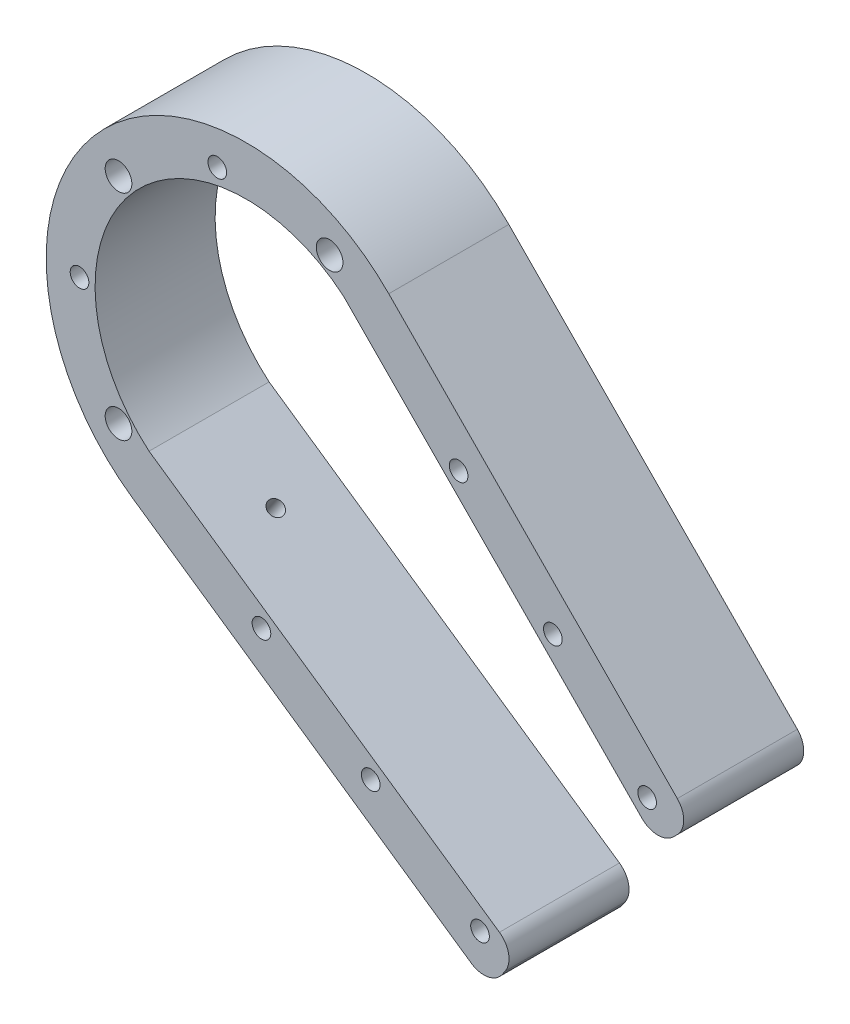
from build123d import *

# Parameters (mm, degrees)
SKETCH1_R           = 1.6
BOSS_EXTRUDE1_DEPTH = 27
CUT_EXTRUDE1_REACH  = 138.335
SKETCH2_R           = 2.1
CUT_EXTRUDE2_REACH  = 155.174
SKETCH3_R           = 1.7
SKETCH3_3_R         = 3
SKETCH3_3_R_2       = 1.7
CUT_EXTRUDE3_DEPTH  = 3
SKETCH4_R           = 3
CUT_EXTRUDE4_DEPTH  = 15


with BuildPart() as part:
    # Sketch1 → Boss-Extrude1 (new body)
    with BuildSketch(Plane.XY.offset(10)):
        with BuildLine():
            Line((-25.534872354, -37.053613776), (50.619597549, -89.534180987))
            ThreePointArc((50.619597549, -89.534180987), (54.361803385, -90.334528675), (57.573873786, -88.254320829))
            Line((57.573873786, -88.254320829), (58.227827632, -87.305369414))
            ThreePointArc((58.227827632, -87.305369414), (59.02817532, -83.563163578), (56.947967474, -80.351093178))
            Line((56.947967474, -80.351093178), (-21.854778729, -26.045511066))
            ThreePointArc((-21.854778729, -26.045511066), (-26.045511066, 21.854778729), (21.854778729, 26.045511066))
            Line((21.854778729, 26.045511066), (89.019290298, -42.129978983))
            ThreePointArc((89.019290298, -42.129978983), (92.543786433, -43.620813626), (96.090160837, -42.182797794))
            Line((96.090160837, -42.182797794), (96.911137653, -41.373995292))
            ThreePointArc((96.911137653, -41.373995292), (98.401972296, -37.849499157), (96.963956464, -34.303124754))
            Line((96.963956464, -34.303124754), (32.056602073, 31.581232775))
            ThreePointArc((32.056602073, 31.581232775), (-34.47199994, 28.925442436), (-25.534872354, -37.053613776))
        make_face()
        with Locations((90.17973297, -37.494440018)):
            Circle(SKETCH1_R, mode=Mode.SUBTRACT)
        with Locations((68.973861607, -16.273907044)):
            Circle(SKETCH1_R, mode=Mode.SUBTRACT)
        with Locations((47.767990244, 4.946625931)):
            Circle(SKETCH1_R, mode=Mode.SUBTRACT)
        with Locations((18.75, 32.475952642)):
            Circle(SKETCH1_R, mode=Mode.SUBTRACT)
        with Locations((-6.511806663, 36.930290738)):
            Circle(SKETCH1_R, mode=Mode.SUBTRACT)
        with Locations((-28.726666617, 24.104535363)):
            Circle(SKETCH1_R, mode=Mode.SUBTRACT)
        with Locations((-37.5, 0)):
            Circle(SKETCH1_R, mode=Mode.SUBTRACT)
        with Locations((-28.726666617, -24.104535363)):
            Circle(SKETCH1_R, mode=Mode.SUBTRACT)
        with Locations((3.423348889, -47.901259716)):
            Circle(SKETCH1_R, mode=Mode.SUBTRACT)
        with Locations((28.003855203, -65.100059364)):
            Circle(SKETCH1_R, mode=Mode.SUBTRACT)
        with Locations((52.584361518, -82.298859012)):
            Circle(SKETCH1_R, mode=Mode.SUBTRACT)
    extrude(amount=BOSS_EXTRUDE1_DEPTH)

    # Sketch2 → Cut-Extrude1 (cut, up to next)
    with BuildSketch(Plane.XY.offset(37), mode=Mode.PRIVATE) as cut_extrude1_sk1:
        with Locations((52.584361518, -82.298859012)):
            Circle(SKETCH2_R)
    cut_extrude1_tool1 = extrude(cut_extrude1_sk1.sketch, amount=-CUT_EXTRUDE1_REACH, mode=Mode.PRIVATE) & part.part
    # Sketch2 → Cut-Extrude1 (cut, up to next)
    with BuildSketch(Plane.XY.offset(37), mode=Mode.PRIVATE) as cut_extrude1_sk2:
        with Locations((28.003855203, -65.100059364)):
            Circle(SKETCH2_R)
    cut_extrude1_tool2 = extrude(cut_extrude1_sk2.sketch, amount=-CUT_EXTRUDE1_REACH, mode=Mode.PRIVATE) & part.part
    # Sketch2 → Cut-Extrude1 (cut, up to next)
    with BuildSketch(Plane.XY.offset(37), mode=Mode.PRIVATE) as cut_extrude1_sk3:
        with Locations((3.423348889, -47.901259716)):
            Circle(SKETCH2_R)
    cut_extrude1_tool3 = extrude(cut_extrude1_sk3.sketch, amount=-CUT_EXTRUDE1_REACH, mode=Mode.PRIVATE) & part.part
    # Sketch2 → Cut-Extrude1 (cut, up to next)
    with BuildSketch(Plane.XY.offset(37), mode=Mode.PRIVATE) as cut_extrude1_sk4:
        with Locations((-28.726666617, -24.104535363)):
            Circle(SKETCH2_R)
    cut_extrude1_tool4 = extrude(cut_extrude1_sk4.sketch, amount=-CUT_EXTRUDE1_REACH, mode=Mode.PRIVATE) & part.part
    # Sketch2 → Cut-Extrude1 (cut, up to next)
    with BuildSketch(Plane.XY.offset(37), mode=Mode.PRIVATE) as cut_extrude1_sk5:
        with Locations((-37.5, 0)):
            Circle(SKETCH2_R)
    cut_extrude1_tool5 = extrude(cut_extrude1_sk5.sketch, amount=-CUT_EXTRUDE1_REACH, mode=Mode.PRIVATE) & part.part
    # Sketch2 → Cut-Extrude1 (cut, up to next)
    with BuildSketch(Plane.XY.offset(37), mode=Mode.PRIVATE) as cut_extrude1_sk6:
        with Locations((-28.726666617, 24.104535363)):
            Circle(SKETCH2_R)
    cut_extrude1_tool6 = extrude(cut_extrude1_sk6.sketch, amount=-CUT_EXTRUDE1_REACH, mode=Mode.PRIVATE) & part.part
    # Sketch2 → Cut-Extrude1 (cut, up to next)
    with BuildSketch(Plane.XY.offset(37), mode=Mode.PRIVATE) as cut_extrude1_sk7:
        with Locations((-6.511806663, 36.930290738)):
            Circle(SKETCH2_R)
    cut_extrude1_tool7 = extrude(cut_extrude1_sk7.sketch, amount=-CUT_EXTRUDE1_REACH, mode=Mode.PRIVATE) & part.part
    # Sketch2 → Cut-Extrude1 (cut, up to next)
    with BuildSketch(Plane.XY.offset(37), mode=Mode.PRIVATE) as cut_extrude1_sk8:
        with Locations((18.75, 32.475952642)):
            Circle(SKETCH2_R)
    cut_extrude1_tool8 = extrude(cut_extrude1_sk8.sketch, amount=-CUT_EXTRUDE1_REACH, mode=Mode.PRIVATE) & part.part
    # Sketch2 → Cut-Extrude1 (cut, up to next)
    with BuildSketch(Plane.XY.offset(37), mode=Mode.PRIVATE) as cut_extrude1_sk9:
        with Locations((47.767990244, 4.946625931)):
            Circle(SKETCH2_R)
    cut_extrude1_tool9 = extrude(cut_extrude1_sk9.sketch, amount=-CUT_EXTRUDE1_REACH, mode=Mode.PRIVATE) & part.part
    # Sketch2 → Cut-Extrude1 (cut, up to next)
    with BuildSketch(Plane.XY.offset(37), mode=Mode.PRIVATE) as cut_extrude1_sk10:
        with Locations((68.973861607, -16.273907044)):
            Circle(SKETCH2_R)
    cut_extrude1_tool10 = extrude(cut_extrude1_sk10.sketch, amount=-CUT_EXTRUDE1_REACH, mode=Mode.PRIVATE) & part.part
    # Sketch2 → Cut-Extrude1 (cut, up to next)
    with BuildSketch(Plane.XY.offset(37), mode=Mode.PRIVATE) as cut_extrude1_sk11:
        with Locations((90.17973297, -37.494440018)):
            Circle(SKETCH2_R)
    cut_extrude1_tool11 = extrude(cut_extrude1_sk11.sketch, amount=-CUT_EXTRUDE1_REACH, mode=Mode.PRIVATE) & part.part
    add(cut_extrude1_tool1.solids().sort_by_distance((52.584362, -82.298859, 37))[0], mode=Mode.SUBTRACT)
    add(cut_extrude1_tool2.solids().sort_by_distance((28.003855, -65.100059, 37))[0], mode=Mode.SUBTRACT)
    add(cut_extrude1_tool3.solids().sort_by_distance((3.423349, -47.90126, 37))[0], mode=Mode.SUBTRACT)
    add(cut_extrude1_tool4.solids().sort_by_distance((-28.726667, -24.104535, 37))[0], mode=Mode.SUBTRACT)
    add(cut_extrude1_tool5.solids().sort_by_distance((-37.5, 0, 37))[0], mode=Mode.SUBTRACT)
    add(cut_extrude1_tool6.solids().sort_by_distance((-28.726667, 24.104535, 37))[0], mode=Mode.SUBTRACT)
    add(cut_extrude1_tool7.solids().sort_by_distance((-6.511807, 36.930291, 37))[0], mode=Mode.SUBTRACT)
    add(cut_extrude1_tool8.solids().sort_by_distance((18.75, 32.475953, 37))[0], mode=Mode.SUBTRACT)
    add(cut_extrude1_tool9.solids().sort_by_distance((47.76799, 4.946626, 37))[0], mode=Mode.SUBTRACT)
    add(cut_extrude1_tool10.solids().sort_by_distance((68.973862, -16.273907, 37))[0], mode=Mode.SUBTRACT)
    add(cut_extrude1_tool11.solids().sort_by_distance((90.179733, -37.49444, 37))[0], mode=Mode.SUBTRACT)

    # Sketch3 → Cut-Extrude2 (cut, up to next)
    with BuildSketch(Plane(origin=(-25.534872354, -37.053613776, 0), x_dir=(0.823413639467006, -0.567441607867893, 0), z_dir=(-0.5674416078678929, -0.8234136394670059, 0)), mode=Mode.PRIVATE) as cut_extrude2_sk1:
        with Locations((15, 23.5)):
            Circle(SKETCH3_R)
    cut_extrude2_tool1 = extrude(cut_extrude2_sk1.sketch, amount=-CUT_EXTRUDE2_REACH, mode=Mode.PRIVATE) & part.part
    add(cut_extrude2_tool1.solids().sort_by_distance((-13.183668, -45.565238, 23.5))[0], mode=Mode.SUBTRACT)

    # Sketch3<3> → Cut-Extrude3 (cut)
    with BuildSketch(Plane(origin=(-25.534872354, -37.053613776, 0), x_dir=(0.823413639467006, -0.567441607867893, 0), z_dir=(-0.5674416078678929, -0.8234136394670059, 0))):
        with Locations((15, 23.5)):
            Circle(SKETCH3_3_R)
        with Locations((15, 23.5)):
            Circle(SKETCH3_3_R_2, mode=Mode.SUBTRACT)
    extrude(amount=-CUT_EXTRUDE3_DEPTH, mode=Mode.SUBTRACT)

    # Sketch4 → Cut-Extrude4 (cut)
    with BuildSketch(Plane.XY.offset(37)):
        with Locations((18.75, 32.475952642)):
            Circle(SKETCH4_R)
        with Locations((-28.726666617, 24.104535363)):
            Circle(SKETCH4_R)
        with Locations((-28.726666617, -24.104535363)):
            Circle(SKETCH4_R)
    extrude(amount=-CUT_EXTRUDE4_DEPTH, mode=Mode.SUBTRACT)


solid = part.part
